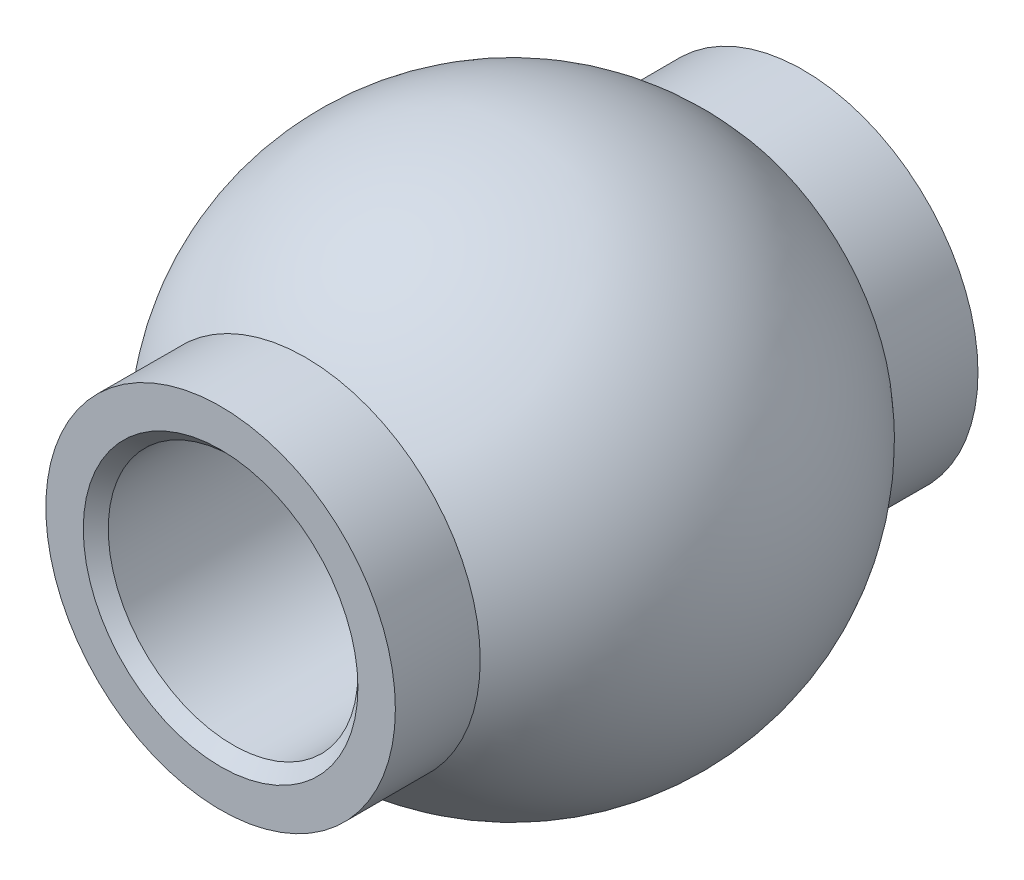
from build123d import *

# Parameters (mm, degrees)
CUT_EXTRUDE4_DEPTH      = 33.794461113
CUT_EXTRUDE4_DEPTH_BACK = 33.794461113
SKETCH10_R              = 4.7625
EXTRUDE1_DEPTH          = 11.1125
EXTRUDE1_DEPTH_BACK     = 11.1125
SKETCH12_R              = 6.6675
SKETCH12_R_2            = 4.7625
CHAMFER1_SIZE           = 0.47625


with BuildPart() as part:
    # Sketch7 → Revolve3 (revolve)
    with BuildSketch(Plane.XY):
        with BuildLine():
            Line((0, 29.36875), (0, 8.73125))
            ThreePointArc((0, 8.73125), (10.31875, 19.05), (0, 29.36875))
        make_face()
    revolve(axis=Axis((0, 0, 0), (0, 1, 0)))

    # Sketch10 → Cut-Extrude4 (cut, two sides: drawn at the far end of the back side and taken through both)
    with BuildSketch(Plane.XY.offset(-CUT_EXTRUDE4_DEPTH_BACK)):
        with Locations(Location((0, 19.05, 0), (0, 0, 180))):
            Circle(SKETCH10_R)
    extrude(amount=CUT_EXTRUDE4_DEPTH + CUT_EXTRUDE4_DEPTH_BACK, mode=Mode.SUBTRACT)

    # Sketch12 → Extrude1 (add, two sides: drawn at the far end of the back side and taken through both)
    with BuildSketch(Plane.XY.offset(-EXTRUDE1_DEPTH_BACK)):
        with Locations((0, 19.05)):
            Circle(SKETCH12_R)
        with Locations((0, 19.05)):
            Circle(SKETCH12_R_2, mode=Mode.SUBTRACT)
    extrude(amount=EXTRUDE1_DEPTH + EXTRUDE1_DEPTH_BACK)

    # Chamfer1
    chamfer1_edges = [part.edges().sort_by_distance(p)[0] for p in [
        (-4.7625, 19.05, 11.1125),
        (-4.7625, 19.05, -11.1125),
    ]]
    chamfer(chamfer1_edges, length=CHAMFER1_SIZE)


solid = part.part
